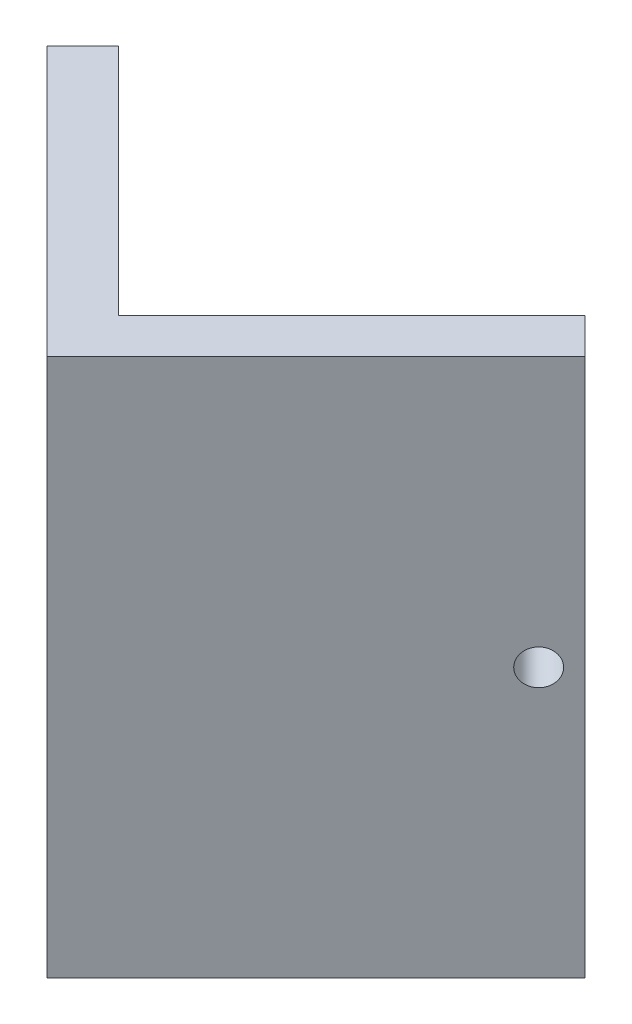
from build123d import *

# Parameters (mm, degrees)
BOSS_EXTRUDE1_DEPTH = 32
SKETCH2_R           = 1.05
CUT_EXTRUDE1_DEPTH  = 32
SKETCH3_R           = 1.05
CUT_EXTRUDE2_DEPTH  = 32


with BuildPart() as part:
    # Sketch1 → Boss-Extrude1 (new body)
    with BuildSketch(Plane(origin=(0, 0, 0), x_dir=(1, 0, 0), z_dir=(0, 1, 0))):
        Polygon((-16, 11.757359313), (0, -4.242640687), (16, 11.757359313), (13.878679656, 13.878679656), (0, 0), (-13.878679656, 13.878679656), align=None)
    extrude(amount=BOSS_EXTRUDE1_DEPTH)

    # Sketch2 → Cut-Extrude1 (cut)
    with BuildSketch(Plane(origin=(0, 0, 0), x_dir=(-0.7071067811865538, 0, -0.7071067811865414), z_dir=(0.7071067811865414, 0, -0.7071067811865538))):
        with Locations((17.677416998, 16)):
            Circle(SKETCH2_R)
    extrude(amount=-CUT_EXTRUDE1_DEPTH, mode=Mode.SUBTRACT)

    # Sketch3 → Cut-Extrude2 (cut)
    with BuildSketch(Plane(origin=(0, 0, 0), x_dir=(-0.7071067811865475, 0, 0.7071067811865477), z_dir=(-0.7071067811865477, 0, -0.7071067811865475))):
        with Locations((-17.677416998, 16)):
            Circle(SKETCH3_R)
    extrude(amount=-CUT_EXTRUDE2_DEPTH, mode=Mode.SUBTRACT)


solid = part.part
